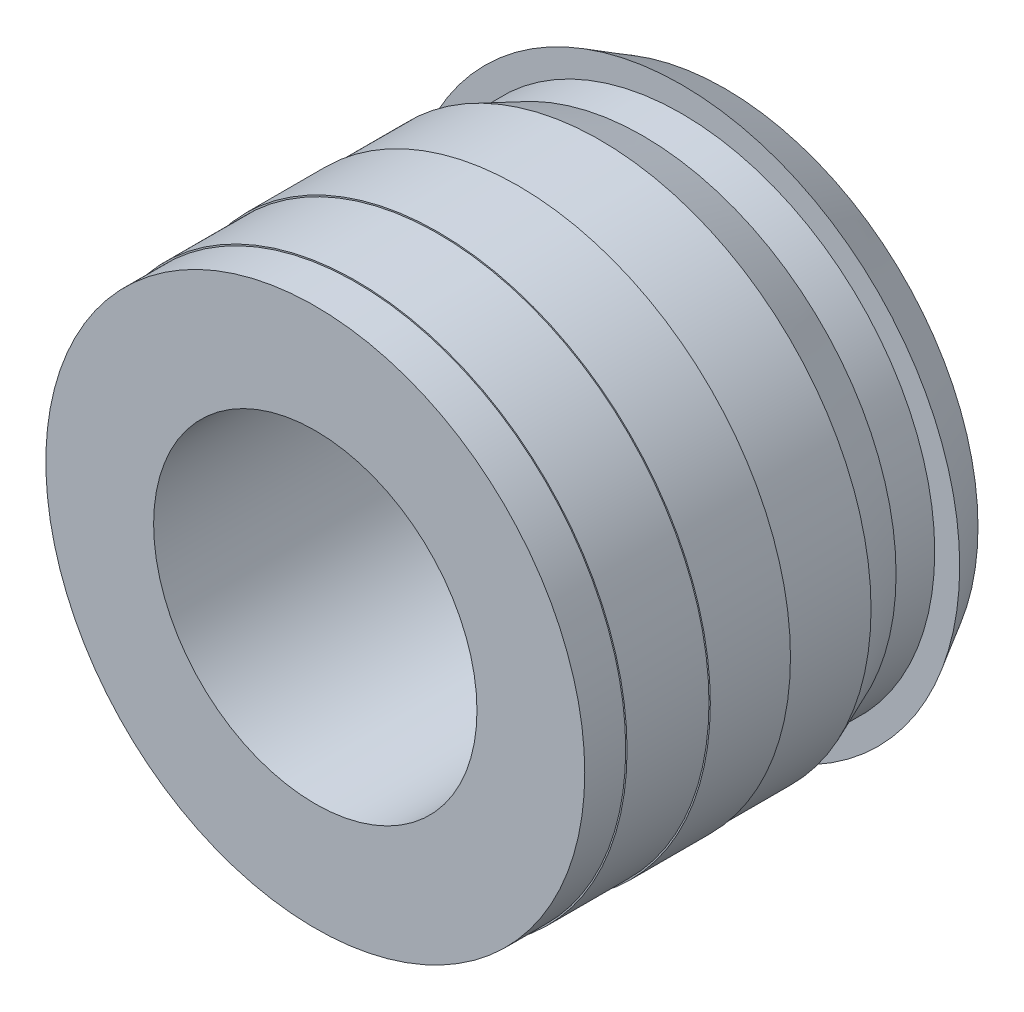
from build123d import *


with BuildPart() as part:
    # Sketch3 → Revolve1 (revolve)
    with BuildSketch(Plane(origin=(0, 0, 0), x_dir=(0, 0, -1), z_dir=(1, 0, 0)), mode=Mode.PRIVATE) as revolve1_sk:
        Polygon((-1.9, 1.5), (-1.9, 2.5), (-1.52, 2.5), (-1.52, 2.5125), (-0.76, 2.5125), (-0.76, 2.525), (-0.016534578, 2.525), (-0.016534578, 2.5125), (0.743465422, 2.5125), (1.14, 2.34825), (1.498597225, 2.34825), (1.498597225, 2.58), (1.9, 2.34825), (1.9, 1.5), align=None)
    revolve(revolve1_sk.sketch.rotate(Axis((0, 0, 1.9), (0, 0, -1)), 90), axis=Axis((0, 0, 1.9), (0, 0, -1)))


solid = part.part
